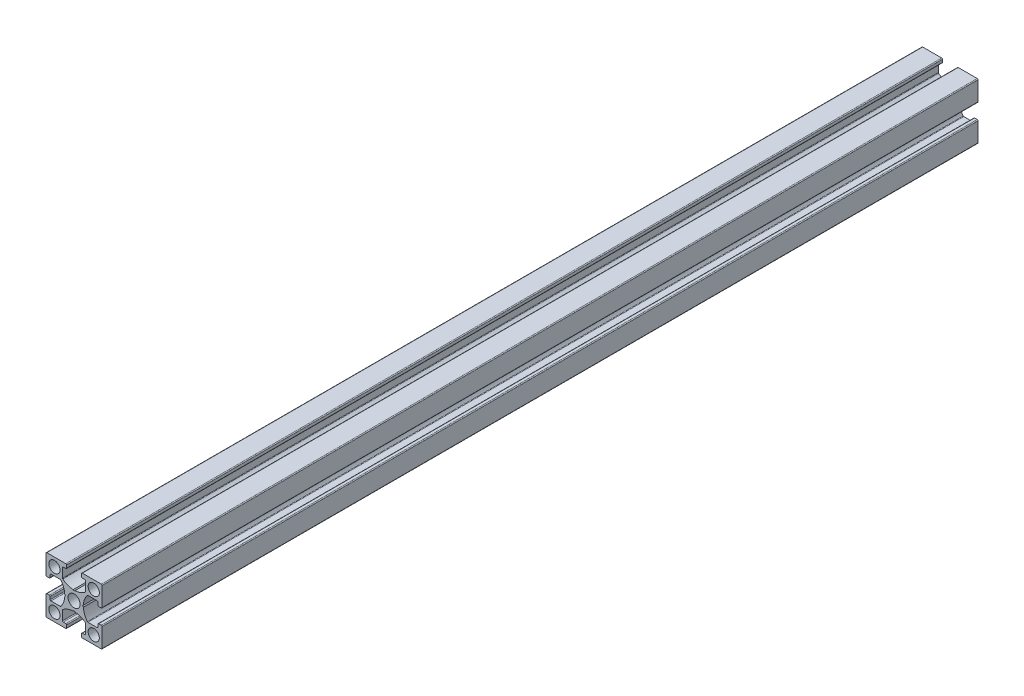
from build123d import *

# Parameters (mm, degrees)
MODEL_R         = 2.15
MODEL_R_2       = 2
EXTRUDE_1_DEPTH = 312


with BuildPart() as part:
    # Model → 보스-돌출1 (new body)
    with BuildSketch(Plane.XY):
        with BuildLine():
            Line((2307.763927197, 1192.134297913), (2307.763927197, 1195.391548465))
            ThreePointArc((2307.763927197, 1195.391548465), (2307.676059232, 1195.603680499), (2307.463927197, 1195.691548465))
            Line((2307.463927197, 1195.691548465), (2306.563927197, 1195.691548465))
            ThreePointArc((2306.563927197, 1195.691548465), (2306.351795163, 1195.779416431), (2306.263927197, 1195.991548465))
            Line((2306.263927197, 1195.991548465), (2306.263927197, 1196.891548465))
            ThreePointArc((2306.263927197, 1196.891548465), (2306.351795163, 1197.103680499), (2306.563927197, 1197.191548465))
            Line((2306.563927197, 1197.191548465), (2313.313927197, 1197.191548465))
            ThreePointArc((2313.313927197, 1197.191548465), (2313.526059232, 1197.103680499), (2313.613927197, 1196.891548465))
            Line((2313.613927197, 1196.891548465), (2313.613927197, 1190.141548465))
            ThreePointArc((2313.613927197, 1190.141548465), (2313.526059232, 1189.929416431), (2313.313927197, 1189.841548465))
            Line((2313.313927197, 1189.841548465), (2312.413927197, 1189.841548465))
            ThreePointArc((2312.413927197, 1189.841548465), (2312.201795163, 1189.929416431), (2312.113927197, 1190.141548465))
            Line((2312.113927197, 1190.141548465), (2312.113927197, 1191.041548465))
            ThreePointArc((2312.113927197, 1191.041548465), (2312.026059232, 1191.253680499), (2311.813927197, 1191.341548465))
            Line((2311.813927197, 1191.341548465), (2308.556676645, 1191.341548465))
            ThreePointArc((2308.556676645, 1191.341548465), (2308.426234796, 1191.311705686), (2308.321744595, 1191.228114625))
            ThreePointArc((2308.321744595, 1191.228114625), (2307.328306374, 1189.47356999), (2306.921204563, 1187.498825831))
            Line((2306.921204563, 1187.498825831), (2306.613927197, 1187.191548465))
            Line((2306.613927197, 1187.191548465), (2306.921204563, 1186.884271099))
            ThreePointArc((2306.921204563, 1186.884271099), (2307.328306374, 1184.90952694), (2308.321744595, 1183.154982305))
            ThreePointArc((2308.321744595, 1183.154982305), (2308.426234796, 1183.071391244), (2308.556676645, 1183.041548465))
            Line((2308.556676645, 1183.041548465), (2311.813927197, 1183.041548465))
            ThreePointArc((2311.813927197, 1183.041548465), (2312.026059232, 1183.129416431), (2312.113927197, 1183.341548465))
            Line((2312.113927197, 1183.341548465), (2312.113927197, 1184.241548465))
            ThreePointArc((2312.113927197, 1184.241548465), (2312.201795163, 1184.453680499), (2312.413927197, 1184.541548465))
            Line((2312.413927197, 1184.541548465), (2313.313927197, 1184.541548465))
            ThreePointArc((2313.313927197, 1184.541548465), (2313.526059232, 1184.453680499), (2313.613927197, 1184.241548465))
            Line((2313.613927197, 1184.241548465), (2313.613927197, 1177.491548465))
            ThreePointArc((2313.613927197, 1177.491548465), (2313.526059232, 1177.279416431), (2313.313927197, 1177.191548465))
            Line((2313.313927197, 1177.191548465), (2306.563927197, 1177.191548465))
            ThreePointArc((2306.563927197, 1177.191548465), (2306.351795163, 1177.279416431), (2306.263927197, 1177.491548465))
            Line((2306.263927197, 1177.491548465), (2306.263927197, 1178.391548465))
            ThreePointArc((2306.263927197, 1178.391548465), (2306.351795163, 1178.603680499), (2306.563927197, 1178.691548465))
            Line((2306.563927197, 1178.691548465), (2307.463927197, 1178.691548465))
            ThreePointArc((2307.463927197, 1178.691548465), (2307.676059232, 1178.779416431), (2307.763927197, 1178.991548465))
            Line((2307.763927197, 1178.991548465), (2307.763927197, 1182.248799017))
            ThreePointArc((2307.763927197, 1182.248799017), (2307.734084418, 1182.379240866), (2307.650493357, 1182.483731067))
            ThreePointArc((2307.650493357, 1182.483731067), (2305.895948722, 1183.477169289), (2303.921204563, 1183.884271099))
            Line((2303.921204563, 1183.884271099), (2303.613927197, 1184.191548465))
            Line((2303.613927197, 1184.191548465), (2303.306649831, 1183.884271099))
            ThreePointArc((2303.306649831, 1183.884271099), (2301.331905673, 1183.477169289), (2299.577361038, 1182.483731067))
            ThreePointArc((2299.577361038, 1182.483731067), (2299.493769977, 1182.379240866), (2299.463927197, 1182.248799017))
            Line((2299.463927197, 1182.248799017), (2299.463927197, 1178.991548465))
            ThreePointArc((2299.463927197, 1178.991548465), (2299.551795163, 1178.779416431), (2299.763927197, 1178.691548465))
            Line((2299.763927197, 1178.691548465), (2300.663927197, 1178.691548465))
            ThreePointArc((2300.663927197, 1178.691548465), (2300.876059232, 1178.603680499), (2300.963927197, 1178.391548465))
            Line((2300.963927197, 1178.391548465), (2300.963927197, 1177.491548465))
            ThreePointArc((2300.963927197, 1177.491548465), (2300.876059232, 1177.279416431), (2300.663927197, 1177.191548465))
            Line((2300.663927197, 1177.191548465), (2293.913927197, 1177.191548465))
            ThreePointArc((2293.913927197, 1177.191548465), (2293.701795163, 1177.279416431), (2293.613927197, 1177.491548465))
            Line((2293.613927197, 1177.491548465), (2293.613927197, 1184.241548465))
            ThreePointArc((2293.613927197, 1184.241548465), (2293.701795163, 1184.453680499), (2293.913927197, 1184.541548465))
            Line((2293.913927197, 1184.541548465), (2294.813927197, 1184.541548465))
            ThreePointArc((2294.813927197, 1184.541548465), (2295.026059232, 1184.453680499), (2295.113927197, 1184.241548465))
            Line((2295.113927197, 1184.241548465), (2295.113927197, 1183.341548465))
            ThreePointArc((2295.113927197, 1183.341548465), (2295.201795163, 1183.129416431), (2295.413927197, 1183.041548465))
            Line((2295.413927197, 1183.041548465), (2298.671177749, 1183.041548465))
            ThreePointArc((2298.671177749, 1183.041548465), (2298.801619599, 1183.071391244), (2298.906109799, 1183.154982305))
            ThreePointArc((2298.906109799, 1183.154982305), (2299.899548021, 1184.90952694), (2300.306649831, 1186.884271099))
            Line((2300.306649831, 1186.884271099), (2300.613927197, 1187.191548465))
            Line((2300.613927197, 1187.191548465), (2300.306649831, 1187.498825831))
            ThreePointArc((2300.306649831, 1187.498825831), (2299.899548021, 1189.47356999), (2298.906109799, 1191.228114625))
            ThreePointArc((2298.906109799, 1191.228114625), (2298.801619599, 1191.311705686), (2298.671177749, 1191.341548465))
            Line((2298.671177749, 1191.341548465), (2295.413927197, 1191.341548465))
            ThreePointArc((2295.413927197, 1191.341548465), (2295.201795163, 1191.253680499), (2295.113927197, 1191.041548465))
            Line((2295.113927197, 1191.041548465), (2295.113927197, 1190.141548465))
            ThreePointArc((2295.113927197, 1190.141548465), (2295.026059232, 1189.929416431), (2294.813927197, 1189.841548465))
            Line((2294.813927197, 1189.841548465), (2293.913927197, 1189.841548465))
            ThreePointArc((2293.913927197, 1189.841548465), (2293.701795163, 1189.929416431), (2293.613927197, 1190.141548465))
            Line((2293.613927197, 1190.141548465), (2293.613927197, 1196.891548465))
            ThreePointArc((2293.613927197, 1196.891548465), (2293.701795163, 1197.103680499), (2293.913927197, 1197.191548465))
            Line((2293.913927197, 1197.191548465), (2300.663927197, 1197.191548465))
            ThreePointArc((2300.663927197, 1197.191548465), (2300.876059232, 1197.103680499), (2300.963927197, 1196.891548465))
            Line((2300.963927197, 1196.891548465), (2300.963927197, 1195.991548465))
            ThreePointArc((2300.963927197, 1195.991548465), (2300.876059232, 1195.779416431), (2300.663927197, 1195.691548465))
            Line((2300.663927197, 1195.691548465), (2299.763927197, 1195.691548465))
            ThreePointArc((2299.763927197, 1195.691548465), (2299.551795163, 1195.603680499), (2299.463927197, 1195.391548465))
            Line((2299.463927197, 1195.391548465), (2299.463927197, 1192.134297913))
            ThreePointArc((2299.463927197, 1192.134297913), (2299.493769977, 1192.003856063), (2299.577361038, 1191.899365863))
            ThreePointArc((2299.577361038, 1191.899365863), (2301.331905673, 1190.905927641), (2303.306649831, 1190.498825831))
            Line((2303.306649831, 1190.498825831), (2303.613927197, 1190.191548465))
            Line((2303.613927197, 1190.191548465), (2303.921204563, 1190.498825831))
            ThreePointArc((2303.921204563, 1190.498825831), (2305.895948722, 1190.905927641), (2307.650493357, 1191.899365863))
            ThreePointArc((2307.650493357, 1191.899365863), (2307.734084418, 1192.003856063), (2307.763927197, 1192.134297913))
        make_face()
        with Locations((2303.613927197, 1187.191548465)):
            Circle(MODEL_R, mode=Mode.SUBTRACT)
        with Locations((2296.613927197, 1194.191548465)):
            Circle(MODEL_R_2, mode=Mode.SUBTRACT)
        with Locations((2296.613927197, 1180.191548465)):
            Circle(MODEL_R_2, mode=Mode.SUBTRACT)
        with Locations((2310.613927197, 1194.191548465)):
            Circle(MODEL_R_2, mode=Mode.SUBTRACT)
        with Locations((2310.613927197, 1180.191548465)):
            Circle(MODEL_R_2, mode=Mode.SUBTRACT)
    extrude(amount=EXTRUDE_1_DEPTH)


solid = part.part
